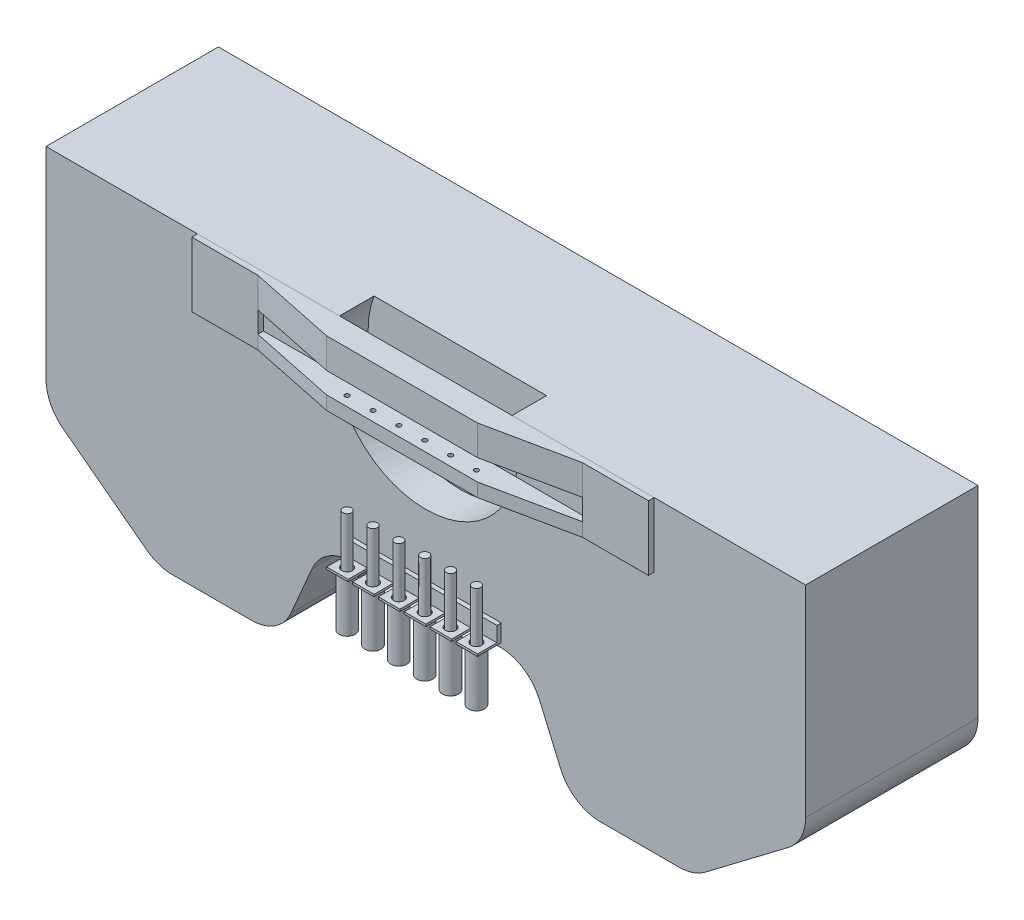
from build123d import *

# Parameters (mm, degrees)
BOSS_EXTRUDE1_DEPTH = 40
SKETCH2_W           = 5
SKETCH2_H           = 4
BOSS_EXTRUDE2_DEPTH = 1
SKETCH3_W           = 5
SKETCH3_H           = 0.5
BOSS_EXTRUDE3_DEPTH = 4.5
SKETCH4_R           = 1.25
CUT_EXTRUDE1_DEPTH  = 4
BOSS_EXTRUDE4_DEPTH = 15
SKETCH6_R           = 21.374587463
CUT_EXTRUDE2_DEPTH  = 8
SKETCH7_W           = 75.333659936
SKETCH7_H           = 4.899460554
CUT_EXTRUDE3_DEPTH  = 5.5
SKETCH8_R           = 0.530981903
CUT_EXTRUDE4_DEPTH  = 6
SKETCH9_R           = 1.862615815
BOSS_EXTRUDE5_DEPTH = 12
SKETCH10_R          = 0.995348299
BOSS_EXTRUDE6_DEPTH = 12


with BuildPart() as part:
    # Sketch1 → Boss-Extrude1 (new body)
    with BuildSketch(Plane.XY):
        with BuildLine():
            Line((-17.205242583, 0), (17.205242583, 0))
            ThreePointArc((17.205242583, 0), (22.704737501, -1.648020855), (26.391575956, -6.048888872))
            Line((26.391575956, -6.048888872), (31.277015737, -17.407536362))
            ThreePointArc((31.277015737, -17.407536362), (34.963854192, -21.808404379), (40.463349111, -23.456425234))
            Line((40.463349111, -23.456425234), (58.768133529, -23.456425234))
            ThreePointArc((58.768133529, -23.456425234), (61.952430736, -22.935889949), (64.805220133, -21.428475493))
            Line((64.805220133, -21.428475493), (84.1429946, -6.784335605))
            ThreePointArc((84.1429946, -6.784335605), (87.060539927, -3.26364098), (88.105907996, 1.187714654))
            Line((88.105907996, 1.187714654), (88.105907996, 47.921728972))
            Line((88.105907996, 47.921728972), (-88.105907996, 47.921728972))
            Line((-88.105907996, 47.921728972), (-88.105907996, 1.187714654))
            ThreePointArc((-88.105907996, 1.187714654), (-87.060539927, -3.26364098), (-84.1429946, -6.784335605))
            Line((-84.1429946, -6.784335605), (-64.805220133, -21.428475493))
            ThreePointArc((-64.805220133, -21.428475493), (-61.952430736, -22.935889949), (-58.768133529, -23.456425234))
            Line((-58.768133529, -23.456425234), (-40.463349111, -23.456425234))
            ThreePointArc((-40.463349111, -23.456425234), (-34.963854192, -21.808404379), (-31.277015737, -17.407536362))
            Line((-31.277015737, -17.407536362), (-26.391575956, -6.048888872))
            ThreePointArc((-26.391575956, -6.048888872), (-22.704737501, -1.648020855), (-17.205242583, 0))
        make_face()
    extrude(amount=BOSS_EXTRUDE1_DEPTH)

    # Sketch2 → Boss-Extrude2 (add)
    with BuildSketch(Plane.XY.offset(40)):
        with Locations((-15, 3)):
            Rectangle(SKETCH2_W, SKETCH2_H)
        with Locations((-9, 3)):
            Rectangle(SKETCH2_W, SKETCH2_H)
        with Locations((-3, 3)):
            Rectangle(SKETCH2_W, SKETCH2_H)
        with Locations((3, 3)):
            Rectangle(SKETCH2_W, SKETCH2_H)
        with Locations((9, 3)):
            Rectangle(SKETCH2_W, SKETCH2_H)
        with Locations((15, 3)):
            Rectangle(SKETCH2_W, SKETCH2_H)
    extrude(amount=BOSS_EXTRUDE2_DEPTH)

    # Sketch3 → Boss-Extrude3 (add)
    with BuildSketch(Plane.XY.offset(41)):
        with Locations((-15, 1.25)):
            Rectangle(SKETCH3_W, SKETCH3_H)
        with Locations((-9, 1.25)):
            Rectangle(SKETCH3_W, SKETCH3_H)
        with Locations((-3, 1.25)):
            Rectangle(SKETCH3_W, SKETCH3_H)
        with Locations((3, 1.25)):
            Rectangle(SKETCH3_W, SKETCH3_H)
        with Locations((9, 1.25)):
            Rectangle(SKETCH3_W, SKETCH3_H)
        with Locations((15, 1.25)):
            Rectangle(SKETCH3_W, SKETCH3_H)
    extrude(amount=BOSS_EXTRUDE3_DEPTH)

    # Sketch4 → Cut-Extrude1 (cut)
    with BuildSketch(Plane.XZ.offset(-1)):
        with Locations(Location((15, 43.25, 0), (0, 0, 270))):
            Circle(SKETCH4_R)
        with Locations(Location((9, 43.25, 0), (0, 0, 270))):
            Circle(SKETCH4_R)
        with Locations(Location((3, 43.25, 0), (0, 0, 270))):
            Circle(SKETCH4_R)
        with Locations(Location((-3, 43.25, 0), (0, 0, 270))):
            Circle(SKETCH4_R)
        with Locations(Location((-9, 43.25, 0), (0, 0, 270))):
            Circle(SKETCH4_R)
        with Locations(Location((-15, 43.25, 0), (0, 0, 270))):
            Circle(SKETCH4_R)
    extrude(amount=-CUT_EXTRUDE1_DEPTH, mode=Mode.SUBTRACT)

    # Sketch6 → Cut-Extrude2 (cut)
    with BuildSketch(Plane.XY.offset(40)):
        with Locations((0, 40.421728972)):
            Circle(SKETCH6_R)
    extrude(amount=-CUT_EXTRUDE2_DEPTH, mode=Mode.SUBTRACT)

    # Sketch9 → Boss-Extrude5 (add)
    with BuildSketch(Plane.XZ.offset(-1)):
        with Locations(Location((15, 43.25, 0), (0, 0, 90))):
            Circle(SKETCH9_R)
        with Locations(Location((9, 43.25, 0), (0, 0, 90))):
            Circle(SKETCH9_R)
        with Locations(Location((3, 43.25, 0), (0, 0, 90))):
            Circle(SKETCH9_R)
        with Locations(Location((-3, 43.25, 0), (0, 0, 90))):
            Circle(SKETCH9_R)
        with Locations(Location((-9, 43.25, 0), (0, 0, 90))):
            Circle(SKETCH9_R)
        with Locations(Location((-15, 43.25, 0), (0, 0, 90))):
            Circle(SKETCH9_R)
    extrude(amount=BOSS_EXTRUDE5_DEPTH)

    # Sketch10 → Boss-Extrude6 (add)
    with BuildSketch(Plane(origin=(0, 1, 0), x_dir=(1, 0, 0), z_dir=(0, 1, 0))):
        with Locations(Location((15, -43.25, 0), (0, 0, 90))):
            Circle(SKETCH10_R)
        with Locations(Location((9, -43.25, 0), (0, 0, 90))):
            Circle(SKETCH10_R)
        with Locations(Location((3, -43.25, 0), (0, 0, 90))):
            Circle(SKETCH10_R)
        with Locations(Location((-3, -43.25, 0), (0, 0, 90))):
            Circle(SKETCH10_R)
        with Locations(Location((-9, -43.25, 0), (0, 0, 90))):
            Circle(SKETCH10_R)
        with Locations(Location((-15, -43.25, 0), (0, 0, 90))):
            Circle(SKETCH10_R)
    extrude(amount=BOSS_EXTRUDE6_DEPTH)


with BuildPart() as body_2:
    # Sketch5 → Boss-Extrude4 (new body)
    with BuildSketch(Plane(origin=(0, 47.921728972, 0), x_dir=(1, 0, 0), z_dir=(0, 1, 0))):
        Polygon((52.968193504, -40), (52.968193504, -41.296406645), (37.666829968, -41.296406645), (17.5, -45.5), (-17.5, -45.5), (-37.666829968, -41.296406645), (-52.968193504, -41.296406645), (-52.968193504, -40), align=None)
    extrude(amount=-BOSS_EXTRUDE4_DEPTH)

    # Sketch7 → Cut-Extrude3 (cut)
    with BuildSketch(Plane.XY.offset(45.5)):
        with Locations((0, 38.504662821)):
            Rectangle(SKETCH7_W, SKETCH7_H)
    extrude(amount=-CUT_EXTRUDE3_DEPTH, mode=Mode.SUBTRACT)

    # Sketch8 → Cut-Extrude4 (cut)
    with BuildSketch(Plane.XZ.offset(-32.921728972)):
        with Locations(Location((15, 43.25, 0), (0, 0, 270))):
            Circle(SKETCH8_R)
        with Locations(Location((9, 43.25, 0), (0, 0, 270))):
            Circle(SKETCH8_R)
        with Locations(Location((3, 43.25, 0), (0, 0, 270))):
            Circle(SKETCH8_R)
        with Locations(Location((-3, 43.25, 0), (0, 0, 270))):
            Circle(SKETCH8_R)
        with Locations(Location((-9, 43.25, 0), (0, 0, 270))):
            Circle(SKETCH8_R)
        with Locations(Location((-15, 43.25, 0), (0, 0, 270))):
            Circle(SKETCH8_R)
    extrude(amount=-CUT_EXTRUDE4_DEPTH, mode=Mode.SUBTRACT)


solid = Compound([part.part, body_2.part])
